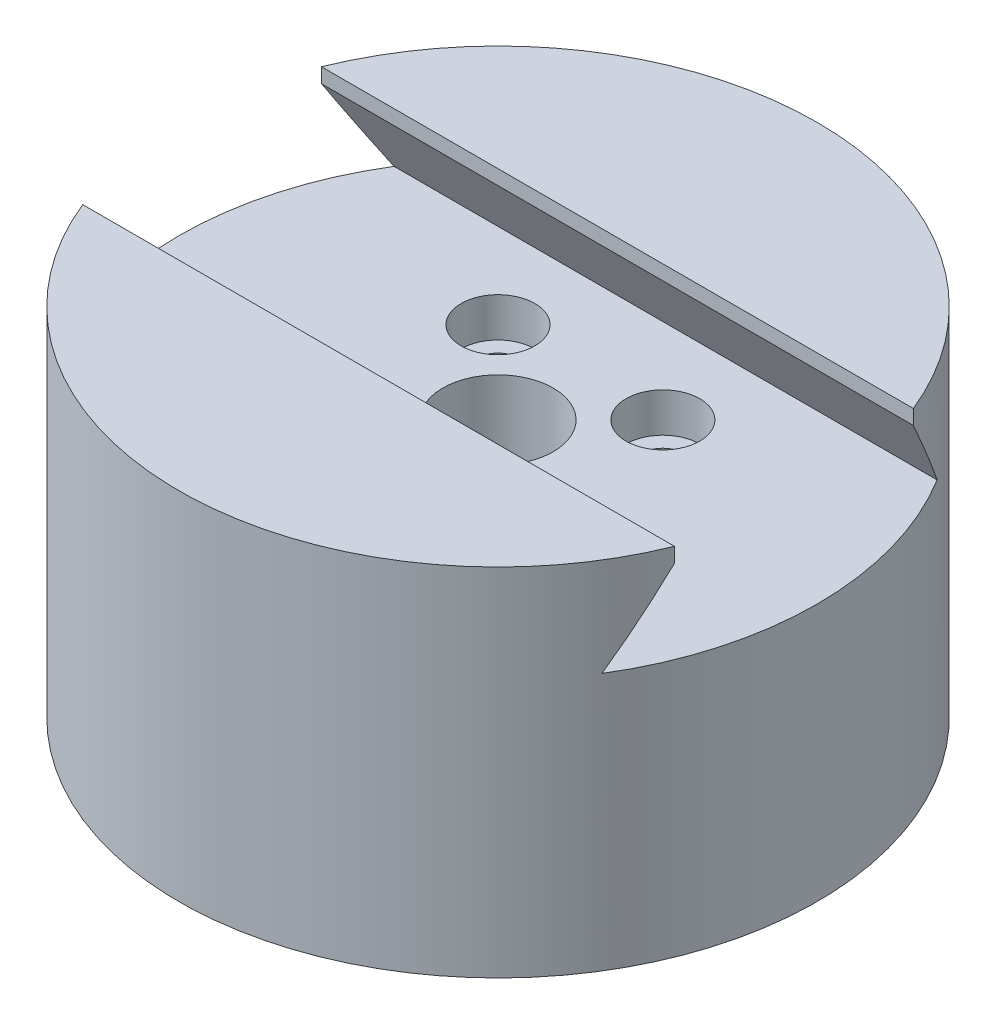
from build123d import *

# Parameters (mm, degrees)
SKETCH_1_R                  = 26
EXTRUDE_1_DEPTH             = 14
CUT_EXTRUDE_1_DEPTH         = 30
SKETCH_4_R                  = 4.5
CUT_EXTRUDE_2_DEPTH         = 40.344631146
CUT_EXTRUDE_3_DEPTH         = 12
HOLE_WIZARD_M31_D           = 3.4
HOLE_WIZARD_M31_CBORE_D     = 6
HOLE_WIZARD_M31_CBORE_DEPTH = 3.2
EXTRUDE_START               = 15
SKETCH_12_R                 = 26
SKETCH_12_R_2               = 24
EXTRUDE_2_DEPTH             = 15


with BuildPart() as part:
    # Эскиз1 → Бобышка-Вытянуть1 (new body)
    with BuildSketch(Plane(origin=(0, 0, 0), x_dir=(1, 0, 0), z_dir=(0, 1, 0))):
        with Locations(Location((0, 0, 0), (0, 0, 270))):
            Circle(SKETCH_1_R)
    extrude(amount=EXTRUDE_1_DEPTH)

    # Эскиз2 → Вырез-Вытянуть1 (cut, symmetric)
    with BuildSketch(Plane(origin=(0, 0, 0), x_dir=(0, 0, -1), z_dir=(1, 0, 0))):
        Polygon((13.654700538, 6), (-13.654700538, 6), (-9.728718708, 12.8), (-9.728718708, 14), (9.728718708, 14), (9.728718708, 12.8), align=None)
    extrude(amount=CUT_EXTRUDE_1_DEPTH, both=True, mode=Mode.SUBTRACT)

    # Эскиз4 → Вырез-Вытянуть2 (cut, through all)
    with BuildSketch(Plane.XZ):
        with Locations(Location((0, 0, 0), (0, 0, 270))):
            Circle(SKETCH_4_R)
    extrude(amount=-CUT_EXTRUDE_2_DEPTH, mode=Mode.SUBTRACT)

    # Эскиз5 → Вырез-Вытянуть3 (cut)
    with BuildSketch(Plane.XZ):
        with BuildLine():
            Line((-18.05935633, -15.654700538), (18.05935633, -15.654700538))
            ThreePointArc((18.05935633, -15.654700538), (0, -23.9), (-18.05935633, -15.654700538))
        make_face()
    extrude(amount=-CUT_EXTRUDE_3_DEPTH, mode=Mode.SUBTRACT)

    # Цековка для винта с внутренним шестигранником M31 (through all)
    with Locations(Plane(origin=(0, 6, 0), x_dir=(1, 0, 0), z_dir=(0, 1, 0))):
        with Locations((-6.717514421, 6.717514421), (6.717514421, 6.717514421), (6.717514421, -6.717514421), (-6.717514421, -6.717514421)):
            CounterBoreHole(HOLE_WIZARD_M31_D / 2, HOLE_WIZARD_M31_CBORE_D / 2, HOLE_WIZARD_M31_CBORE_DEPTH)

    # Эскиз12 → Бобышка-Вытянуть2 (add)
    with BuildSketch(Plane.XZ.offset(EXTRUDE_START)):
        with Locations(Location((0, 0, 0), (0, 0, 270))):
            Circle(SKETCH_12_R)
        with Locations(Location((0, 0, 0), (0, 0, 270))):
            Circle(SKETCH_12_R_2, mode=Mode.SUBTRACT)
    extrude(amount=-EXTRUDE_2_DEPTH)


solid = part.part
